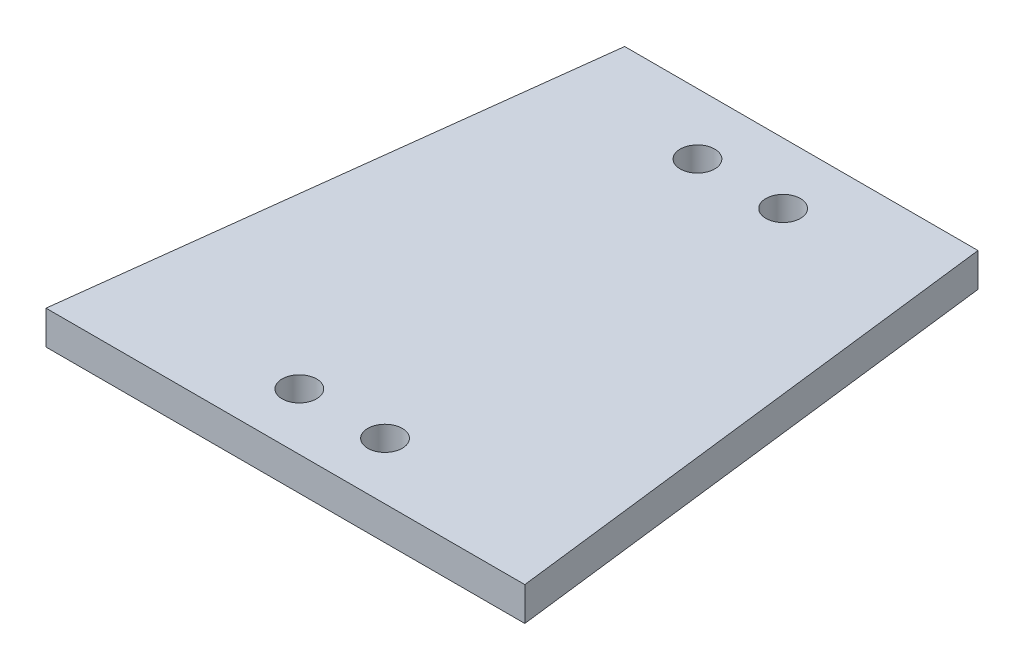
from build123d import *

# Parameters (mm, degrees)
BOSS_EXTRUDE1_DEPTH            = 4
F_4_1_4_1_DIAMETER_HOLE1_D     = 4.1
F_4_1_4_1_DIAMETER_HOLE1_DEPTH = 16
CHAMFER1_SIZE                  = 1


with BuildPart() as part:
    # Sketch1 → Boss-Extrude1 (new body)
    with BuildSketch(Plane(origin=(0, -13.999999791, 0), x_dir=(1, 0, 0), z_dir=(0, 1, 0))):
        Polygon((-28.418499998, 23.757663266), (28.418499998, 23.757663266), (20.970528274, 85.000000013), (-20.970528274, 85.000000013), align=None)
    extrude(amount=-BOSS_EXTRUDE1_DEPTH)

    # Sketch2 → Revolve1 (revolve)
    with BuildSketch(Plane(origin=(0, 0, -64.665000013), x_dir=(-1, 0, 0), z_dir=(0, 0, -1)), mode=Mode.PRIVATE) as revolve1_sk:
        Polygon((-3.85, -29.999999791), (0, -29.999999791), (0, -17.999999791), (-8, -17.999999791), (-8, -23.999999791), (-3.85, -23.999999791), align=None)
    revolve(revolve1_sk.sketch.rotate(Axis((0, -29.999999791, -64.665000013), (0, 1, 0)), 180), axis=Axis((0, -29.999999791, -64.665000013), (0, 1, 0)))

    # Ø4.1 (4.1) Diameter Hole1
    with Locations(Plane(origin=(0, -13.999999791, 0), x_dir=(1, 0, 0), z_dir=(0, 1, 0))):
        with Locations((-5.085, 30.495), (5.085, 30.495), (5.085, 77.755), (-5.085, 77.755)):
            Hole(F_4_1_4_1_DIAMETER_HOLE1_D / 2, depth=F_4_1_4_1_DIAMETER_HOLE1_DEPTH)

    # Chamfer1
    chamfer1_edges = [part.edges().sort_by_distance(p)[0] for p in [
        (3.85, -29.999999791, -64.665000013),
        (8, -23.999999791, -64.665000013),
    ]]
    chamfer(chamfer1_edges, length=CHAMFER1_SIZE)


solid = part.part
